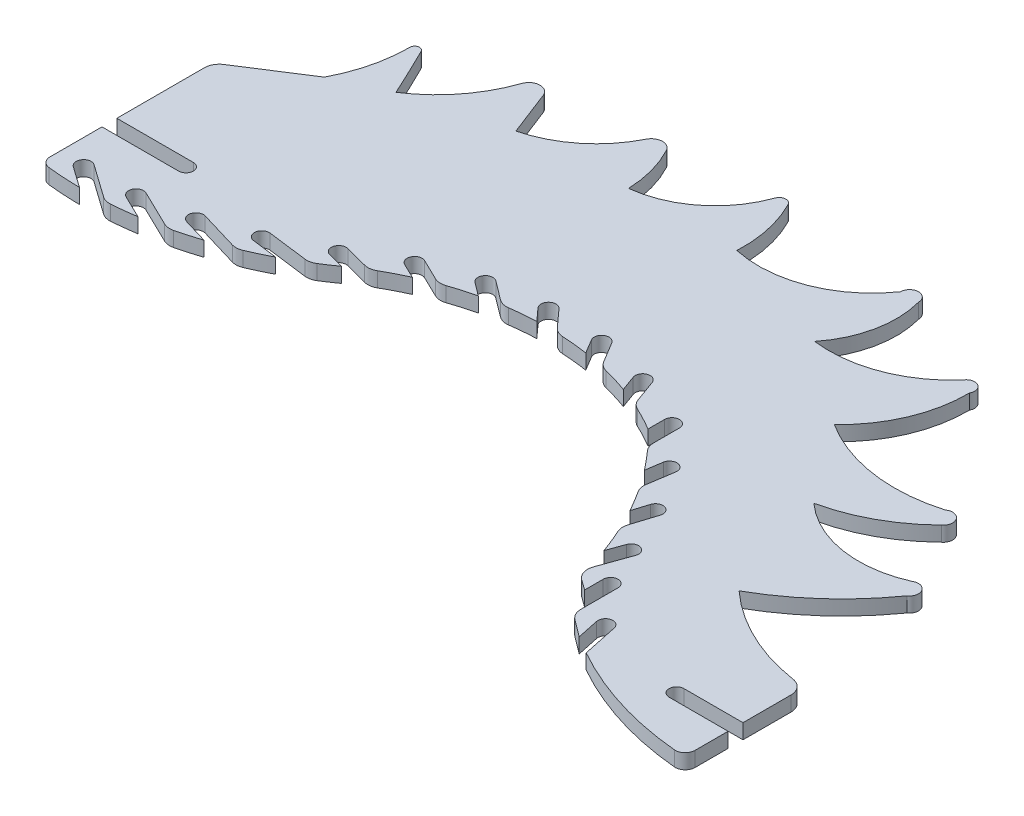
from build123d import *

# Parameters (mm, degrees)
BOSS_EXTRUDE1_DEPTH = 3
FILLET1_R           = 3
FILLET2_R           = 2
FILLET3_R           = 3


with BuildPart() as part:
    # Sketch1 → Boss-Extrude1 (new body)
    with BuildSketch(Plane(origin=(0, 0, 0), x_dir=(1, 0, 0), z_dir=(0, 1, 0))):
        with BuildLine():
            Line((0, 0), (-11.9, 0))
            ThreePointArc((-11.9, 0), (-13.4, -1.5), (-11.9, -3))
            Line((-11.9, -3), (0, -3))
            Line((0, -3), (0, -11.81))
            ThreePointArc((0, -11.81), (-14.472760581, -9.33127549), (-28, -3.62))
            Line((-28, -3.62), (-29.521164874, 3.544255393))
            ThreePointArc((-29.521164874, 3.544255393), (-31.3, 4.7), (-32.455744607, 2.921164874))
            Line((-32.455744607, 2.921164874), (-31.51276538, -1.52))
            Line((-31.51276538, -1.52), (-36.154254994, 1.95))
            Line((-36.154254994, 1.95), (-36.154254994, 10.96))
            ThreePointArc((-36.154254994, 10.96), (-37.654254994, 12.46), (-39.154254994, 10.96))
            Line((-39.154254994, 10.96), (-39.154254994, 7.21))
            Line((-39.154254994, 7.21), (-43.054254994, 10.02))
            Line((-43.054254994, 10.02), (-40.045722247, 18.391072762))
            ThreePointArc((-40.045722247, 18.391072762), (-40.95, 20.31), (-42.868927238, 19.405722247))
            Line((-42.868927238, 19.405722247), (-44.082149392, 16.03))
            ThreePointArc((-44.082149392, 16.03), (-45.222319739, 18.964571548), (-46.49969517, 21.842072304))
            Line((-46.49969517, 21.842072304), (-44.579329128, 27.922952603))
            ThreePointArc((-44.579329128, 27.922952603), (-45.557981292, 29.805036539), (-47.440065228, 28.826384375))
            Line((-47.440065228, 28.826384375), (-48.445885934, 25.641431517))
            ThreePointArc((-48.445885934, 25.641431517), (-49.939100175, 28.203829515), (-51.544744053, 30.697317034))
            Line((-51.544744053, 30.697317034), (-50.573219985, 36.999780991))
            ThreePointArc((-50.573219985, 36.999780991), (-51.827184167, 38.710796429), (-53.538199605, 37.456832246))
            Line((-53.538199605, 37.456832246), (-54.047050003, 34.155821602))
            ThreePointArc((-54.047050003, 34.155821602), (-55.913215675, 36.460815735), (-57.88, 38.680575111))
            Line((-57.88, 38.680575111), (-57.88, 45.057479607))
            ThreePointArc((-57.88, 45.057479607), (-59.38, 46.557479607), (-60.88, 45.057479607))
            Line((-60.88, 45.057479607), (-60.88, 41.717479607))
            ThreePointArc((-60.88, 41.717479607), (-63.667068497, 43.264182629), (-66.54, 44.644872898))
            Line((-66.54, 44.644872898), (-68.597785529, 50.298592173))
            ThreePointArc((-68.597785529, 50.298592173), (-70.520354675, 51.195100889), (-71.416863391, 49.272531743))
            Line((-71.416863391, 49.272531743), (-70.278571651, 46.145100889))
            ThreePointArc((-70.278571651, 46.145100889), (-73.347472166, 47.144625873), (-76.47028294, 47.960256574))
            Line((-76.47028294, 47.960256574), (-79.573687895, 53.114662515))
            ThreePointArc((-79.573687895, 53.114662515), (-81.632457597, 53.626001263), (-82.143796345, 51.567231561))
            Line((-82.143796345, 51.567231561), (-80.427106156, 48.716002593))
            ThreePointArc((-80.427106156, 48.716002593), (-83.630695873, 49.108702849), (-86.851944729, 49.310584926))
            Line((-86.851944729, 49.310584926), (-90.88586279, 53.774498903))
            ThreePointArc((-90.88586279, 53.774498903), (-93.004472595, 53.881701959), (-93.111675651, 51.763092154))
            Line((-93.111675651, 51.763092154), (-90.880259623, 49.293818102))
            ThreePointArc((-90.880259623, 49.293818102), (-94.099716335, 49.065128247), (-97.299926084, 48.645773825))
            Line((-97.299926084, 48.645773825), (-102.114737888, 52.253627786))
            ThreePointArc((-102.114737888, 52.253627786), (-104.214607854, 51.952718952), (-103.913699021, 49.852848986))
            Line((-103.913699021, 49.852848986), (-101.250321117, 47.857116046))
            ThreePointArc((-101.250321117, 47.857116046), (-104.366234103, 47.015518263), (-107.426707901, 45.990481337))
            Line((-107.426707901, 45.990481337), (-112.84383048, 48.608458779))
            ThreePointArc((-112.84383048, 48.608458779), (-114.847075732, 47.910598865), (-114.149215819, 45.907353613))
            Line((-114.149215819, 45.907353613), (-111.152661609, 44.459184182))
            ThreePointArc((-111.152661609, 44.459184182), (-114.049460622, 43.035893612), (-116.856684479, 41.443193143))
            Line((-116.856684479, 41.443193143), (-122.675194955, 42.974192412))
            ThreePointArc((-122.675194955, 42.974192412), (-124.507514461, 41.905265274), (-123.438587323, 40.072945768))
            Line((-123.438587323, 40.072945768), (-120.22, 39.226052931))
            ThreePointArc((-120.22, 39.226052931), (-122.130810504, 37.91089066), (-124.085404111, 36.661725973))
            Line((-124.085404111, 36.661725973), (-133.201211912, 37.826139832))
            ThreePointArc((-133.201211912, 37.826139832), (-134.879181598, 36.528288634), (-133.5813304, 34.850318948))
            Line((-133.5813304, 34.850318948), (-128.447772492, 34.194580466))
            ThreePointArc((-128.447772492, 34.194580466), (-131.166271961, 32.86279471), (-133.941398342, 31.653428662))
            Line((-133.941398342, 31.653428662), (-142.747666571, 34.280870646))
            ThreePointArc((-142.747666571, 34.280870646), (-144.613912239, 33.272343449), (-143.605385042, 31.406097782))
            Line((-143.605385042, 31.406097782), (-138.64614403, 29.926456496))
            ThreePointArc((-138.64614403, 29.926456496), (-141.544646969, 29.053202022), (-144.4791725, 28.309930489))
            Line((-144.4791725, 28.309930489), (-152.742718566, 32.330828141))
            ThreePointArc((-152.742718566, 32.330828141), (-154.747823596, 31.638329899), (-154.055325354, 29.633224868))
            Line((-154.055325354, 29.633224868), (-149.401717777, 27.368860438))
            ThreePointArc((-149.401717777, 27.368860438), (-152.403474262, 26.977260292), (-155.41969517, 26.719764481))
            Line((-155.41969517, 26.719764481), (-162.921707309, 32.027647804))
            ThreePointArc((-162.921707309, 32.027647804), (-165.012578204, 31.669515289), (-164.654445689, 29.578644394))
            Line((-164.654445689, 29.578644394), (-160.42969517, 26.589515289))
            ThreePointArc((-160.42969517, 26.589515289), (-164.583860714, 26.762024861), (-168.71969517, 27.188316155))
            Line((-168.71969517, 27.188316155), (-168.71969517, 39.428316155))
            Line((-168.71969517, 39.428316155), (-153.26969517, 39.428316155))
            ThreePointArc((-153.26969517, 39.428316155), (-151.76969517, 40.928316155), (-153.26969517, 42.428316155))
            Line((-153.26969517, 42.428316155), (-168.71969517, 42.428316155))
            Line((-168.71969517, 42.428316155), (-168.71969517, 61.718316155))
            Line((-168.71969517, 61.718316155), (-154.97969517, 70.548316155))
            ThreePointArc((-154.97969517, 70.548316155), (-152.427356059, 77.262330075), (-151.55969517, 84.392518181))
            ThreePointArc((-151.55969517, 84.392518181), (-150.818108815, 85.328316155), (-149.737615052, 84.820180937))
            ThreePointArc((-149.737615052, 84.820180937), (-147.382689286, 79.982663325), (-145.105861662, 75.107900975))
            ThreePointArc((-145.105861662, 75.107900975), (-138.338315476, 81.303798165), (-133.956265042, 89.365215991))
            ThreePointArc((-133.956265042, 89.365215991), (-131.871910246, 90.88119984), (-129.731541419, 89.445385354))
            Line((-129.731541419, 89.445385354), (-126.235861662, 80.434580466))
            ThreePointArc((-126.235861662, 80.434580466), (-117.683005247, 84.724454595), (-111.681225051, 92.176501788))
            ThreePointArc((-111.681225051, 92.176501788), (-109.702148951, 93.419160866), (-107.687529176, 92.234994088))
            ThreePointArc((-107.687529176, 92.234994088), (-105.674016695, 87.172361666), (-104.865861662, 81.78428548))
            ThreePointArc((-104.865861662, 81.78428548), (-94.760346639, 85.983021815), (-88.401689579, 94.889104066))
            ThreePointArc((-88.401689579, 94.889104066), (-87.233402896, 95.774045948), (-85.956947781, 95.053852748))
            ThreePointArc((-85.956947781, 95.053852748), (-83.657021666, 88.648283331), (-83.100317918, 81.865137997))
            ThreePointArc((-83.100317918, 81.865137997), (-69.828381219, 82.918079825), (-59.38, 91.169402151))
            ThreePointArc((-59.38, 91.169402151), (-57.567745971, 92.98165618), (-55.755491942, 91.169402151))
            ThreePointArc((-55.755491942, 91.169402151), (-55.490451605, 82.06533391), (-59.38, 73.829696824))
            ThreePointArc((-59.38, 73.829696824), (-47.491282563, 75.241319694), (-37.654254994, 82.06533391))
            ThreePointArc((-37.654254994, 82.06533391), (-35.386857444, 82.701978015), (-34.750213339, 80.434580466))
            ThreePointArc((-34.750213339, 80.434580466), (-36.797944646, 70.007982254), (-42.868927238, 61.287298558))
            ThreePointArc((-42.868927238, 61.287298558), (-30.212205095, 56.590662372), (-16.746463394, 57.5523314))
            ThreePointArc((-16.746463394, 57.5523314), (-14.115302595, 57.148635399), (-14.518998596, 54.5174746))
            ThreePointArc((-14.518998596, 54.5174746), (-22.213696249, 48.822896746), (-31.178351733, 45.465585178))
            ThreePointArc((-31.178351733, 45.465585178), (-19.97556246, 40.118304816), (-7.665463567, 41.717479607))
            ThreePointArc((-7.665463567, 41.717479607), (-5.128000509, 41.21803817), (-5.627441946, 38.680575111))
            ThreePointArc((-5.627441946, 38.680575111), (-13.63807278, 29.672013228), (-23.42, 22.626568355))
            ThreePointArc((-23.42, 22.626568355), (-12.55613394, 15.556844164), (0, 12.34))
            Line((0, 12.34), (0, 0))
        make_face()
    extrude(amount=BOSS_EXTRUDE1_DEPTH)

    # Fillet1
    fillet1_edges = [part.edges().sort_by_distance(p)[0] for p in [
        (0, 1.5, -12.34),
    ]]
    fillet(fillet1_edges, radius=FILLET1_R)

    # Fillet2
    fillet2_edges = [part.edges().sort_by_distance(p)[0] for p in [
        (0, 1.5, 11.81),
        (-168.71969517, 1.5, -27.188316155),
    ]]
    fillet(fillet2_edges, radius=FILLET2_R)

    # Fillet3
    fillet3_edges = [part.edges().sort_by_distance(p)[0] for p in [
        (-36.154254994, 1.5, -1.95),
        (-43.054254994, 1.5, -10.02),
        (-46.49969517, 1.5, -21.842072304),
        (-51.544744053, 1.5, -30.697317034),
        (-57.88, 1.5, -38.680575111),
        (-66.54, 1.5, -44.644872898),
        (-76.47028294, 1.5, -47.960256574),
        (-86.851944729, 1.5, -49.310584926),
        (-97.299926084, 1.5, -48.645773825),
        (-107.426707901, 1.5, -45.990481337),
        (-116.856684479, 1.5, -41.443193143),
        (-124.085404111, 1.5, -36.661725973),
        (-133.941398342, 1.5, -31.653428662),
        (-144.4791725, 1.5, -28.309930489),
        (-155.41969517, 1.5, -26.719764481),
        (-168.71969517, 1.5, -61.718316155),
    ]]
    fillet(fillet3_edges, radius=FILLET3_R)


solid = part.part
